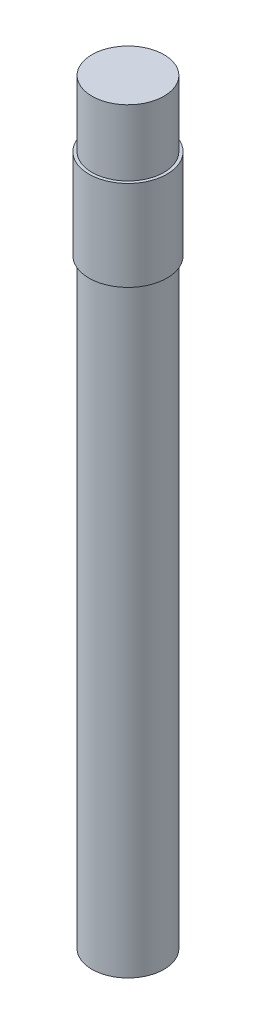
from build123d import *

# Parameters (mm, degrees)
SKETCH_1_R               = 6
EXTRUDE_1015_DEPTH       = 100
SKETCH_2_R               = 6.5
EXTRUDE_2_DEPTH          = 15
SKETCH_3_R               = 6
EXTRUDE_3_DEPTH          = 11
SKETCH_4_R               = 5.5
CUT_EXTRUDE_1_DEPTH      = 2
SKETCH_5_R               = 3.5
SKETCH_5_R_2             = 0.75
EXTRUDE_1402_DEPTH       = 2
SKETCH_6_W               = 1.5
SKETCH_6_H               = 0.8
EXTRUDE_1605_DEPTH       = 1
PATTERN_CIRCULAR_1_COUNT = 8


with BuildPart() as part:
    # Эскиз1 → Extrude 1015 (new body)
    with BuildSketch(Plane(origin=(0, 0, 0), x_dir=(1, 0, 0), z_dir=(0, 1, 0))):
        with Locations(Location((0, 0, 0), (0, 0, 270))):
            Circle(SKETCH_1_R)
    extrude(amount=EXTRUDE_1015_DEPTH)

    # Эскиз2 → Бобышка-Вытянуть2 (add)
    with BuildSketch(Plane(origin=(0, 100, 0), x_dir=(1, 0, 0), z_dir=(0, 1, 0))):
        with Locations(Location((0, 0, 0), (0, 0, 270))):
            Circle(SKETCH_2_R)
    extrude(amount=EXTRUDE_2_DEPTH)

    # Эскиз3 → Бобышка-Вытянуть3 (add)
    with BuildSketch(Plane(origin=(0, 115, 0), x_dir=(1, 0, 0), z_dir=(0, 1, 0))):
        with Locations(Location((0, 0, 0), (0, 0, 270))):
            Circle(SKETCH_3_R)
    extrude(amount=EXTRUDE_3_DEPTH)

    # Эскиз4 → Вырез-Вытянуть1 (cut)
    with BuildSketch(Plane.XZ):
        with Locations(Location((0, 0, 0), (0, 0, 270))):
            Circle(SKETCH_4_R)
    extrude(amount=-CUT_EXTRUDE_1_DEPTH, mode=Mode.SUBTRACT)

    # Эскиз5 → Extrude 1402 (add)
    with BuildSketch(Plane.XZ.offset(-2)):
        with Locations(Location((0, 0, 0), (0, 0, 270))):
            Circle(SKETCH_5_R)
        with Locations(Location((0, 0, 0), (0, 0, 270))):
            Circle(SKETCH_5_R_2, mode=Mode.SUBTRACT)
    extrude(amount=EXTRUDE_1402_DEPTH)

    # Эскиз6 → Extrude 1605 (add)
    with BuildSketch(Plane.XZ.offset(-2)):
        with Locations((0, 4.5)):
            Rectangle(SKETCH_6_W, SKETCH_6_H)
    extrude_1605 = extrude(amount=EXTRUDE_1605_DEPTH)

    # Круговой массив1: Extrude 1605 ×8 about axis
    pattern_circular_1_axis = Axis((0, 0, 0), (0, 1, 0))
    for i in range(1, PATTERN_CIRCULAR_1_COUNT):
        add(extrude_1605.rotate(pattern_circular_1_axis, i * 360 / PATTERN_CIRCULAR_1_COUNT))


solid = part.part
